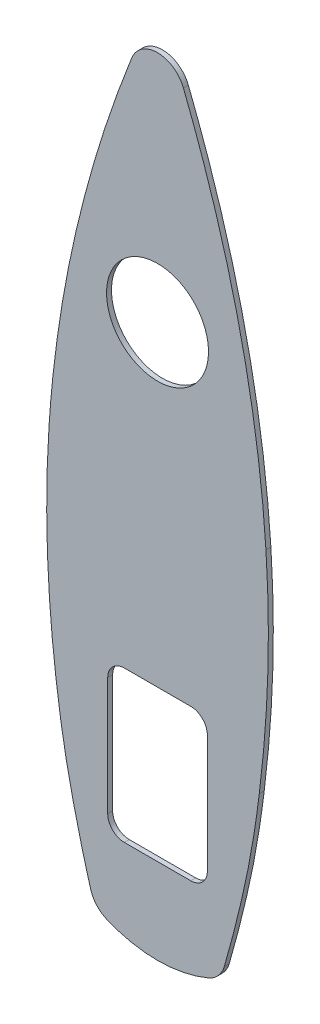
from build123d import *

# Parameters (mm, degrees)
BOSS_EXTRUDE2_DEPTH     = 9.525
CUT_EXTRUDE2_DEPTH      = 20
CUT_EXTRUDE2_DEPTH_BACK = 20
SKETCH5_R               = 98.25
SKETCH5_W               = 192
SKETCH5_H               = 291
FILLET1_R               = 32


with BuildPart() as part:
    # Sketch3 → Boss-Extrude2 (new body)
    with BuildSketch(Plane.XY):
        with BuildLine():
            ThreePointArc((-128.594557171, -271.683003432), (-117.156149866, -292.20930741), (-98.031335876, -305.862431833))
            ThreePointArc((-98.031335876, -305.862431833), (0, -325.672487157), (98.031335876, -305.862431833))
            ThreePointArc((98.031335876, -305.862431833), (117.156149866, -292.20930741), (128.594557171, -271.683003432))
            add(Edge.make_bspline(
                [(128.594557171, -271.683003432), (128.929001137, -270.550670561), (129.607009929, -268.248148567), (132.92675238, -256.894775015), (138.372363082, -237.609630026), (145.587498555, -210.232026724), (152.54164904, -182.662401273), (159.273671104, -155.04724849), (165.68462346, -127.4627227), (173.662799668, -90.634906462), (182.437600317, -44.41870561), (190.23386569, 5.92326819), (194.466912187, 37.721145483), (196.09738159, 50.8)],
                knots=[0.178448909, 0.178448909, 0.178448909, 0.178448909, 0.182331107, 0.186345522, 0.217403108, 0.248460695, 0.279518282, 0.310575869, 0.341633456, 0.372691043, 0.434806217, 0.496921391, 0.540232629, 0.540232629, 0.540232629, 0.540232629], degree=3))
            add(Edge.make_bspline(
                [(196.09738159, 50.8), (196.805263519, 56.478294089), (199.763447664, 80.926441622), (204.336033541, 124.225867737), (208.913068108, 180.752800745), (213.041680781, 256.162202935), (214.132905766, 331.756352431), (212.168857378, 407.250169642), (210.17648868, 444.979630563), (208.923145523, 463.823648231)],
                knots=[0.540232629, 0.540232629, 0.540232629, 0.540232629, 0.559036565, 0.621151739, 0.683266912, 0.745382086, 0.869612434, 0.931727608, 0.993842782, 0.993842782, 0.993842782, 0.993842782], degree=3))
            add(Edge.make_bspline(
                [(208.923145523, 463.823648231), (207.922427582, 478.869564138), (205.602175882, 508.953742276), (199.706639723, 568.910060357), (189.991147, 643.543237919), (177.216824309, 717.777671868), (165.195396161, 776.883168245), (152.011482075, 835.667387937), (133.349255404, 908.643148932), (111.913437805, 980.768947108), (93.147501113, 1037.903472604), (78.26260519, 1080.480419865), (66.491586651, 1112.150932405), (58.40099204, 1133.20563378), (54.364426792, 1143.620772929), (51.51701688, 1150.938010972), (50.030240387, 1154.735608428), (49.858718612, 1155.173455571)],
                knots=[0, 0, 0, 0, 0.062482564, 0.124965127, 0.249930255, 0.374895382, 0.437377946, 0.499860509, 0.624825636, 0.749790764, 0.812273327, 0.874755891, 0.937238455, 0.952859096, 0.968479737, 0.983464396, 0.985416976, 0.985416976, 0.985416976, 0.985416976], degree=3))
            ThreePointArc((49.858718612, 1155.173455571), (0, 1189.189732385), (-49.858718612, 1155.173455571))
            add(Edge.make_bspline(
                [(-208.923145523, 463.823648231), (-207.922427582, 478.869564138), (-205.602175882, 508.953742276), (-199.706639723, 568.910060357), (-189.991147, 643.543237919), (-177.216824309, 717.777671868), (-165.195396161, 776.883168245), (-152.011482075, 835.667387937), (-133.349255404, 908.643148932), (-111.913437805, 980.768947108), (-93.147501113, 1037.903472604), (-78.26260519, 1080.480419865), (-66.491586651, 1112.150932405), (-58.40099204, 1133.20563378), (-54.364426792, 1143.620772929), (-51.51701688, 1150.938010972), (-50.030240387, 1154.735608428), (-49.858718612, 1155.173455571)],
                knots=[0, 0, 0, 0, 0.062482564, 0.124965127, 0.249930255, 0.374895382, 0.437377946, 0.499860509, 0.624825636, 0.749790764, 0.812273327, 0.874755891, 0.937238455, 0.952859096, 0.968479737, 0.983464396, 0.985416976, 0.985416976, 0.985416976, 0.985416976], degree=3))
            add(Edge.make_bspline(
                [(-196.09738159, 50.8), (-196.805263519, 56.478294089), (-199.763447664, 80.926441622), (-204.336033541, 124.225867737), (-208.913068108, 180.752800745), (-213.041680781, 256.162202935), (-214.132905766, 331.756352431), (-212.168857378, 407.250169642), (-210.17648868, 444.979630563), (-208.923145523, 463.823648231)],
                knots=[0.540232629, 0.540232629, 0.540232629, 0.540232629, 0.559036565, 0.621151739, 0.683266912, 0.745382086, 0.869612434, 0.931727608, 0.993842782, 0.993842782, 0.993842782, 0.993842782], degree=3))
            add(Edge.make_bspline(
                [(-128.594557171, -271.683003432), (-128.929001137, -270.550670561), (-129.607009929, -268.248148567), (-132.92675238, -256.894775015), (-138.372363082, -237.609630026), (-145.587498555, -210.232026724), (-152.54164904, -182.662401273), (-159.273671104, -155.04724849), (-165.68462346, -127.4627227), (-173.662799668, -90.634906462), (-182.437600317, -44.41870561), (-190.23386569, 5.92326819), (-194.466912187, 37.721145483), (-196.09738159, 50.8)],
                knots=[0.178448909, 0.178448909, 0.178448909, 0.178448909, 0.182331107, 0.186345522, 0.217403108, 0.248460695, 0.279518282, 0.310575869, 0.341633456, 0.372691043, 0.434806217, 0.496921391, 0.540232629, 0.540232629, 0.540232629, 0.540232629], degree=3))
        make_face()
    extrude(amount=-BOSS_EXTRUDE2_DEPTH)

    # Sketch5 → Cut-Extrude2 (cut, two sides: drawn at the far end of the back side and taken through both)
    with BuildSketch(Plane.XY.offset(-CUT_EXTRUDE2_DEPTH_BACK)):
        with Locations((0, 739.189732385)):
            Circle(SKETCH5_R)
        with Locations((0, -15.172487157)):
            Rectangle(SKETCH5_W, SKETCH5_H)
    extrude(amount=CUT_EXTRUDE2_DEPTH + CUT_EXTRUDE2_DEPTH_BACK, mode=Mode.SUBTRACT)

    # Fillet1
    fillet1_edges = [part.edges().sort_by_distance(p)[0] for p in [
        (-96, -160.672487157, -4.7625),
        (96, -160.672487157, -4.7625),
        (96, 130.327512843, -4.7625),
        (-96, 130.327512843, -4.7625),
    ]]
    fillet(fillet1_edges, radius=FILLET1_R)


solid = part.part
